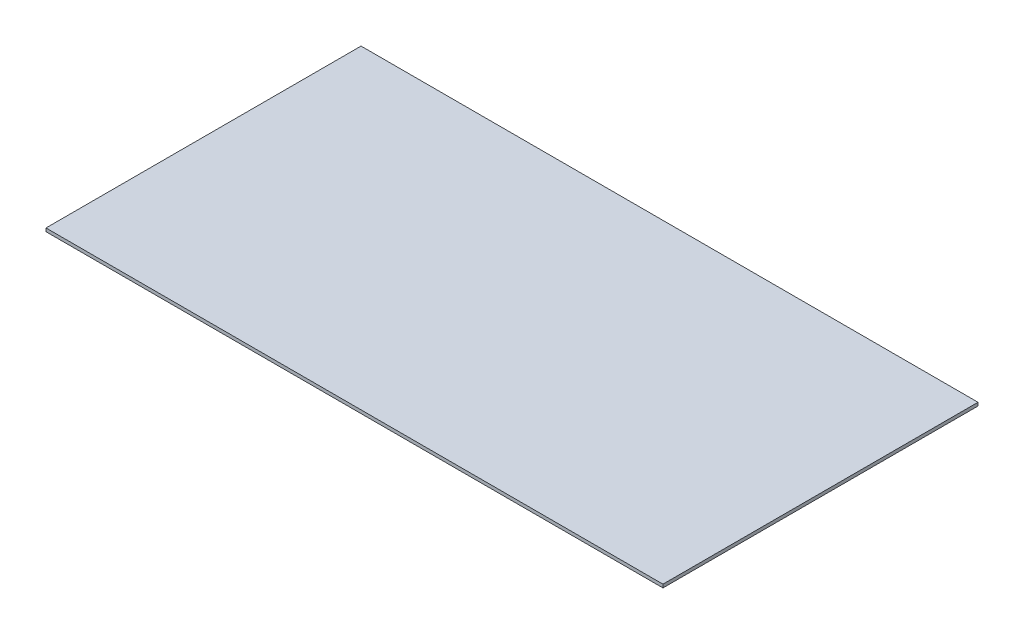
from build123d import *

# Parameters (mm, degrees)
SKETCH1_W           = 1193.8
SKETCH1_H           = 609.6
BOSS_EXTRUDE1_DEPTH = 6.35


with BuildPart() as part:
    # Sketch1 → Boss-Extrude1 (new body)
    with BuildSketch(Plane(origin=(0, 0, 0), x_dir=(1, 0, 0), z_dir=(0, 1, 0))):
        Rectangle(SKETCH1_W, SKETCH1_H)
    extrude(amount=BOSS_EXTRUDE1_DEPTH)


solid = part.part
